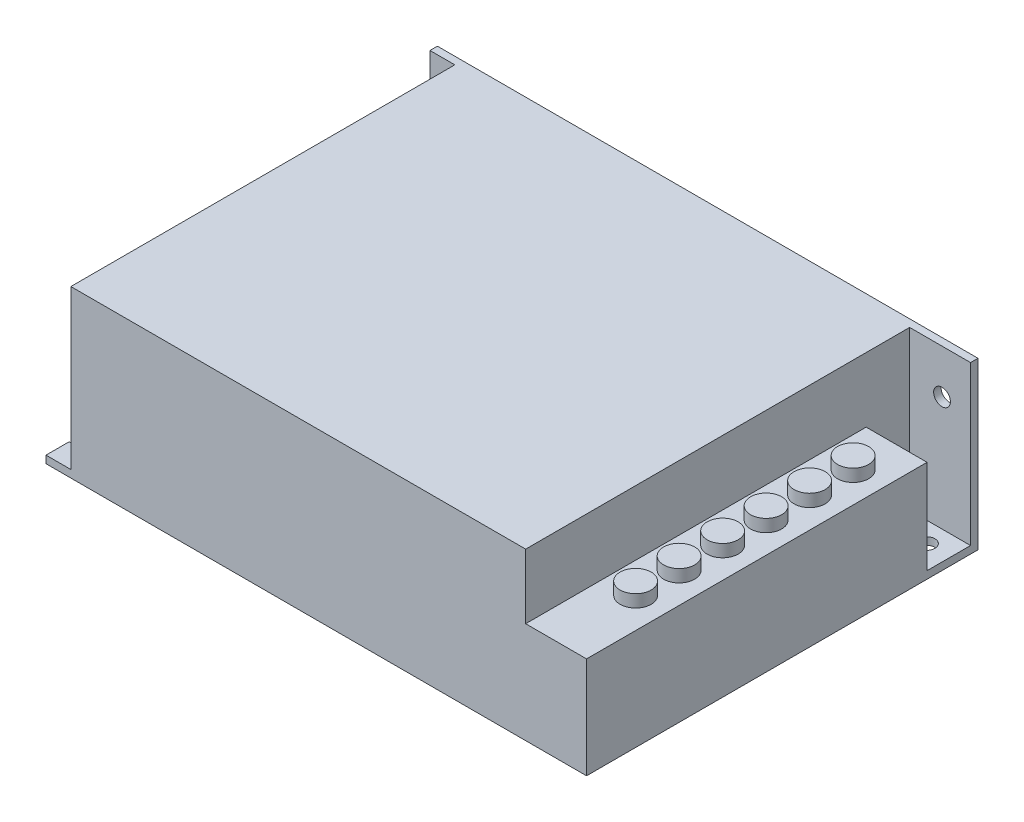
from build123d import *

# Parameters (mm, degrees)
SKETCH1_W                = 110.49
SKETCH1_H                = 80.01
BOSS_EXTRUDE1_DEPTH      = 33.909
SKETCH2_W                = 12.446
SKETCH2_H                = 78.486
CUT_EXTRUDE1_DEPTH       = 13.208
SKETCH3_W                = 8.89
SKETCH3_H                = 19.177
CUT_EXTRUDE2_DEPTH       = 12.446
CUT_EXTRUDE5_DEPTH       = 5.08
CUT_EXTRUDE3_REACH       = 104.973
SKETCH4_R                = 1.7145
SKETCH5_R                = 1.7145
CUT_EXTRUDE4_DEPTH       = 77.172372492
SKETCH8_R                = 3.175
BOSS_EXTRUDE2_DEPTH      = 2.54
LPATTERN1_COUNT          = 6
LPATTERN1_PITCH          = 8.89
M3_CLEARANCE_HOLE1_D     = 3.4
M3_CLEARANCE_HOLE1_DEPTH = 2.999994
M3_CLEARANCE_HOLE1_TIP   = 1.021463052


with BuildPart() as part:
    # Sketch1 → Boss-Extrude1 (new body)
    with BuildSketch(Plane(origin=(0, 0, 0), x_dir=(1, 0, 0), z_dir=(0, 1, 0))):
        Rectangle(SKETCH1_W, SKETCH1_H)
    extrude(amount=BOSS_EXTRUDE1_DEPTH)

    # Sketch2 → Cut-Extrude1 (cut)
    with BuildSketch(Plane(origin=(0, 33.909, 0), x_dir=(1, 0, 0), z_dir=(0, 1, 0))):
        with Locations((49.022, -0.762)):
            Rectangle(SKETCH2_W, SKETCH2_H)
    extrude(amount=-CUT_EXTRUDE1_DEPTH, mode=Mode.SUBTRACT)

    # Sketch3 → Cut-Extrude2 (cut)
    with BuildSketch(Plane(origin=(55.245, 0, 0), x_dir=(0, 0, -1), z_dir=(1, 0, 0))):
        with Locations((34.036, 11.1125)):
            Rectangle(SKETCH3_W, SKETCH3_H)
    extrude(amount=-CUT_EXTRUDE2_DEPTH, mode=Mode.SUBTRACT)

    # Sketch6 → Cut-Extrude5 (cut)
    with BuildSketch(Plane.ZY.offset(55.245)):
        Polygon((-38.481, 33.909), (40.005, 33.909), (40.005, 1.524), (29.845, 1.524), (29.845, 13.462), (-38.481, 13.462), align=None)
    extrude(amount=-CUT_EXTRUDE5_DEPTH, mode=Mode.SUBTRACT)

    # Sketch4 → Cut-Extrude3 (cut, up to next)
    with BuildSketch(Plane(origin=(0, 0, -40.005), x_dir=(-1, 0, 0), z_dir=(0, 0, -1)), mode=Mode.PRIVATE) as cut_extrude3_sk1:
        with Locations((-49.4157, 24.9047)):
            Circle(SKETCH4_R)
    cut_extrude3_tool1 = extrude(cut_extrude3_sk1.sketch, amount=-CUT_EXTRUDE3_REACH, mode=Mode.PRIVATE) & part.part
    # Sketch4 → Cut-Extrude3 (cut, up to next)
    with BuildSketch(Plane(origin=(0, 0, -40.005), x_dir=(-1, 0, 0), z_dir=(0, 0, -1)), mode=Mode.PRIVATE) as cut_extrude3_sk2:
        with BuildLine():
            Line((51.816, 26.543), (55.245, 26.543))
            Line((55.245, 26.543), (55.245, 23.2918))
            Line((55.245, 23.2918), (51.816, 23.2918))
            ThreePointArc((51.816, 23.2918), (50.1904, 24.9174), (51.816, 26.543))
        make_face()
    cut_extrude3_tool2 = extrude(cut_extrude3_sk2.sketch, amount=-CUT_EXTRUDE3_REACH, mode=Mode.PRIVATE) & part.part
    add(cut_extrude3_tool1.solids().sort_by_distance((49.4157, 24.9047, -40.005))[0], mode=Mode.SUBTRACT)
    add(cut_extrude3_tool2.solids().sort_by_distance((-52.878141, 24.9174, -40.005))[0], mode=Mode.SUBTRACT)

    # Sketch5 → Cut-Extrude4 (cut, through all)
    with BuildSketch(Plane(origin=(0, 0, 0), x_dir=(-1, 0, 0), z_dir=(0, -1, 0))):
        with Locations(Location((-50.3936, 34.3281, 0), (0, 0, 90))):
            Circle(SKETCH5_R)
        with BuildLine():
            Line((51.816, -35.2806), (55.245, -35.2806))
            Line((55.245, -35.2806), (55.245, -32.1056))
            Line((55.245, -32.1056), (51.816, -32.1056))
            ThreePointArc((51.816, -32.1056), (50.2285, -33.6931), (51.816, -35.2806))
        make_face()
    extrude(amount=-CUT_EXTRUDE4_DEPTH, mode=Mode.SUBTRACT)

    # Sketch8 → Boss-Extrude2 (add)
    with BuildSketch(Plane(origin=(0, 20.701, 0), x_dir=(1, 0, 0), z_dir=(0, 1, 0))):
        with Locations(Location((49.022, 20.701, 0), (0, 0, 270))):
            Circle(SKETCH8_R)
    boss_extrude2 = extrude(amount=BOSS_EXTRUDE2_DEPTH)

    # LPattern1: Boss-Extrude2 ×6
    with Locations(*[(0, 0, i * LPATTERN1_PITCH) for i in range(1, LPATTERN1_COUNT)]):
        add(boss_extrude2)

    # M3 Clearance Hole1
    with Locations(Plane(origin=(0, 0, 0), x_dir=(-1, 0, 0), z_dir=(0, -1, 0))):
        with Locations((-39.8936, -12.6719), (20.1064, -12.6719)):
            Hole(M3_CLEARANCE_HOLE1_D / 2, depth=M3_CLEARANCE_HOLE1_DEPTH)
            with Locations((0, 0, -(M3_CLEARANCE_HOLE1_DEPTH + M3_CLEARANCE_HOLE1_TIP / 2))):  # 118° drill point
                Cone(0, M3_CLEARANCE_HOLE1_D / 2, M3_CLEARANCE_HOLE1_TIP, mode=Mode.SUBTRACT)


solid = part.part
